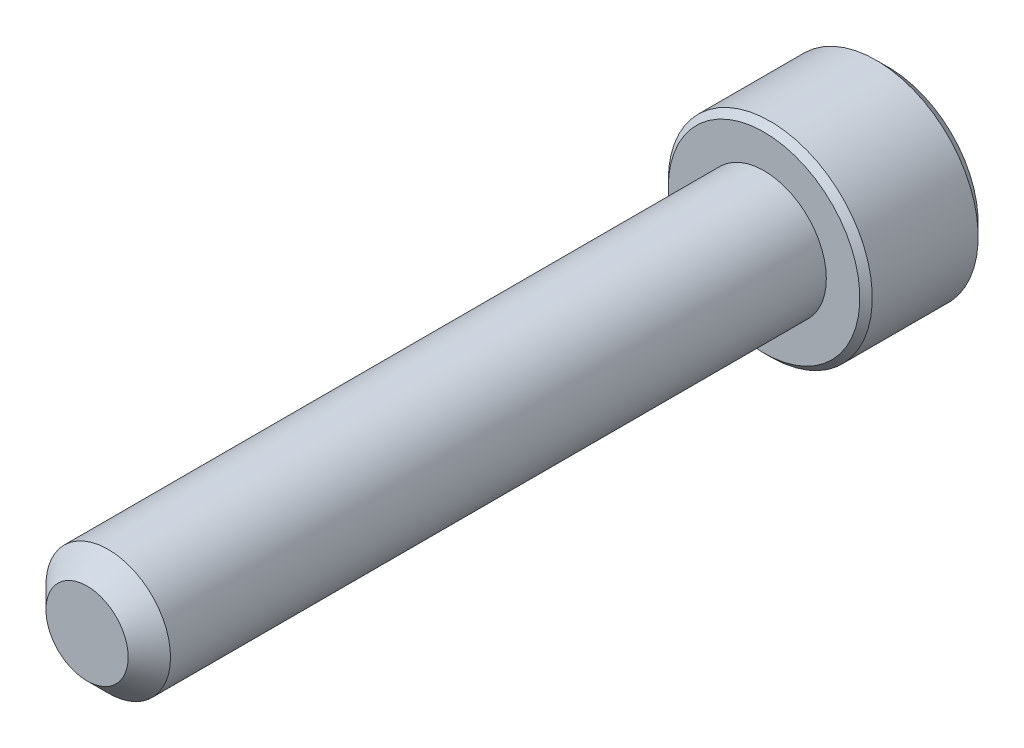
from build123d import *

# Parameters (mm, degrees)
SKETCH1_R          = 1.7526
EXTRUDE1_DEPTH     = 19.05
CHAMFER3_SIZE      = 0.5953125
SKETCH6_R          = 2.8702
EXTRUDE2_DEPTH     = 3.5052
CUT_EXTRUDE1_DEPTH = 2.08359375
SKETCH8_R          = 1.603951217
CUT_EXTRUDE2_DEPTH = 0.35052
CUT_EXTRUDE2_DRAFT = -45
CHAMFER1_SIZE      = 0.35052
CHAMFER2_SIZE      = 0.17526


with BuildPart() as part:
    # Sketch1 → Extrude1 (new body)
    with BuildSketch(Plane.XY):
        Circle(SKETCH1_R)
    extrude(amount=-EXTRUDE1_DEPTH)

    # Chamfer3
    chamfer3_edges = [part.edges().sort_by_distance(p)[0] for p in [
        (-1.7526, 0, 0),
    ]]
    chamfer(chamfer3_edges, length=CHAMFER3_SIZE)

    # Sketch6 → Extrude2 (add)
    with BuildSketch(Plane(origin=(0, 0, -19.05), x_dir=(-1, 0, 0), z_dir=(0, 0, -1))):
        Circle(SKETCH6_R)
    extrude(amount=EXTRUDE2_DEPTH)

    # Sketch7 → Cut-Extrude1 (cut)
    with BuildSketch(Plane(origin=(0, 0, -22.5552), x_dir=(-1, 0, 0), z_dir=(0, 0, -1))):
        Polygon((0, 1.603951217), (-1.3890625, 0.801975608), (-1.3890625, -0.801975608), (0, -1.603951217), (1.3890625, -0.801975608), (1.3890625, 0.801975608), align=None)
    extrude(amount=-CUT_EXTRUDE1_DEPTH, mode=Mode.SUBTRACT)


with BuildPart() as cut_extrude2_tool:
    # Sketch8 → Cut-Extrude2 (with draft: the straight prism first)
    with BuildSketch(Plane(origin=(0, 0, -22.5552), x_dir=(-1, 0, 0), z_dir=(0, 0, -1))):
        Circle(SKETCH8_R)
    extrude(amount=-CUT_EXTRUDE2_DEPTH)
    # Cut-Extrude2: the draft: its side faces are tilted about the plane it starts from
    cut_extrude2_sides = [cut_extrude2_tool.faces().sort_by_distance(p)[0] for p in [
        (1.603951217, 0, -22.37994),
    ]]
    draft(cut_extrude2_sides, Plane(origin=(0, 0, -22.5552), x_dir=(-1, 0, 0), z_dir=(0, 0, -1)), CUT_EXTRUDE2_DRAFT)


with BuildPart() as part_1:
    add(part.part)

    # Cut-Extrude2: cut by cut_extrude2_tool
    add(cut_extrude2_tool.part, mode=Mode.SUBTRACT)

    # Chamfer1
    chamfer1_edges = [part_1.edges().sort_by_distance(p)[0] for p in [
        (2.8702, 0, -22.5552),
    ]]
    chamfer(chamfer1_edges, length=CHAMFER1_SIZE)

    # Chamfer2
    chamfer2_edges = [part_1.edges().sort_by_distance(p)[0] for p in [
        (2.8702, 0, -19.05),
    ]]
    chamfer(chamfer2_edges, length=CHAMFER2_SIZE)


solid = part_1.part
